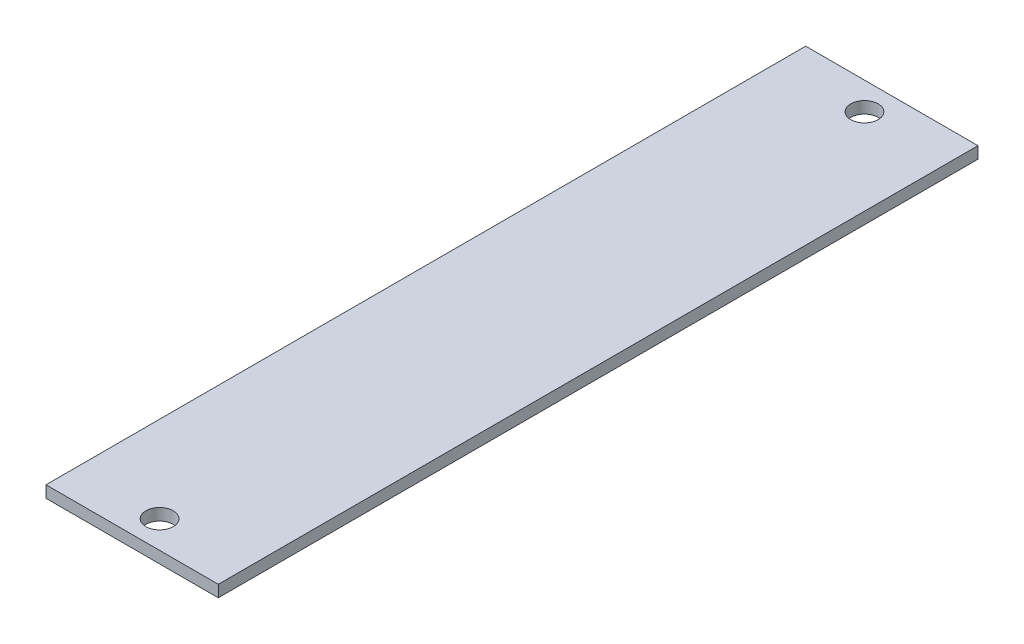
from build123d import *

# Parameters (mm, degrees)
SKETCH1_W           = 22
SKETCH1_H           = 97
BOSS_EXTRUDE1_DEPTH = 1.5
SKETCH2_R           = 1.75
CUT_EXTRUDE1_DEPTH  = 50.754396791


with BuildPart() as part:
    # Sketch1 → Boss-Extrude1 (new body)
    with BuildSketch(Plane(origin=(0, 0, 0), x_dir=(1, 0, 0), z_dir=(0, 1, 0))):
        Rectangle(SKETCH1_W, SKETCH1_H)
    extrude(amount=BOSS_EXTRUDE1_DEPTH)

    # Sketch2 → Cut-Extrude1 (cut, through all)
    with BuildSketch(Plane(origin=(0, 1.5, 0), x_dir=(1, 0, 0), z_dir=(0, 1, 0))):
        with Locations(Location((0, 45, 0), (0, 0, 270))):
            Circle(SKETCH2_R)
        with Locations(Location((0, -45, 0), (0, 0, 270))):
            Circle(SKETCH2_R)
    extrude(amount=-CUT_EXTRUDE1_DEPTH, mode=Mode.SUBTRACT)


solid = part.part
